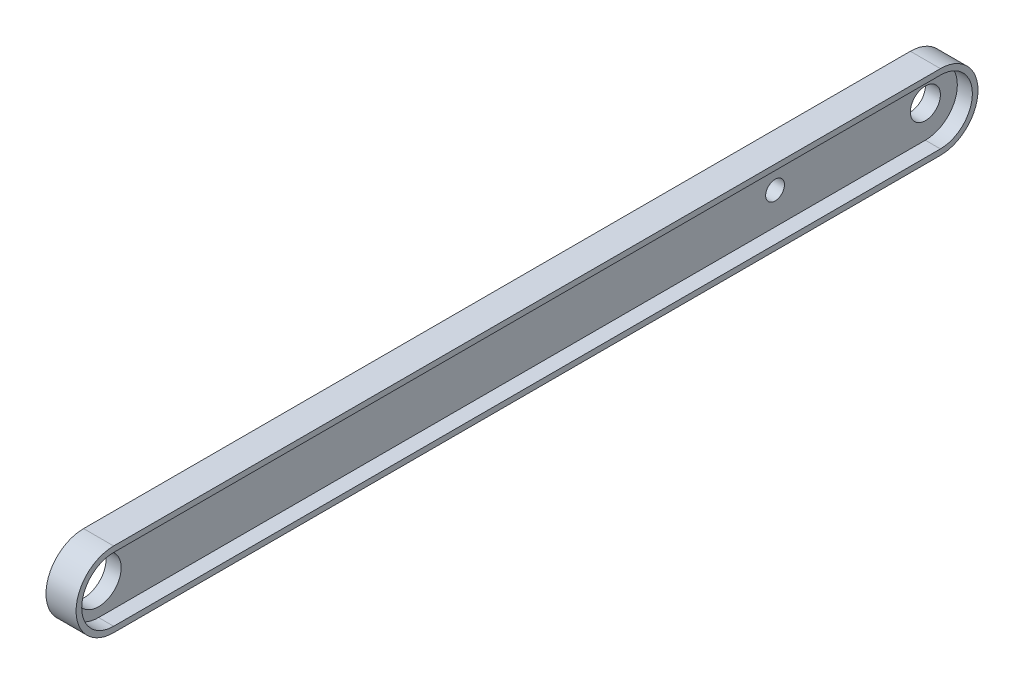
from build123d import *

# Parameters (mm, degrees)
SKETCH1_R           = 3
SKETCH1_R_2         = 2
SKETCH1_R_3         = 1.25
BOSS_EXTRUDE1_DEPTH = 2
BOSS_EXTRUDE3_DEPTH = 2


with BuildPart() as part:
    # Sketch1 → Boss-Extrude1 (new body)
    with BuildSketch(Plane(origin=(0, 0, 0), x_dir=(0, 0, -1), z_dir=(1, 0, 0))):
        with BuildLine():
            Line((0, 0), (110, 0))
            ThreePointArc((110, 0), (115, 5), (110, 10))
            Line((110, 10), (0, 10))
            ThreePointArc((0, 10), (-5, 5), (0, 0))
        make_face()
        with Locations((0, 5)):
            Circle(SKETCH1_R, mode=Mode.SUBTRACT)
        with Locations((110, 5)):
            Circle(SKETCH1_R_2, mode=Mode.SUBTRACT)
        with Locations((90, 5)):
            Circle(SKETCH1_R_3, mode=Mode.SUBTRACT)
    extrude(amount=BOSS_EXTRUDE1_DEPTH)

    # Sketch2 → Boss-Extrude3 (add)
    with BuildSketch(Plane(origin=(2, 0, 0), x_dir=(0, 0, -1), z_dir=(1, 0, 0))):
        with BuildLine():
            Line((0, 0), (110, 0))
            ThreePointArc((110, 0), (115, 5), (110, 10))
            Line((110, 10), (0, 10))
            ThreePointArc((0, 10), (-5, 5), (0, 0))
        make_face()
        with BuildLine():
            Line((0, 9.25), (110, 9.25))
            ThreePointArc((110, 9.25), (114.25, 5), (110, 0.75))
            Line((110, 0.75), (0, 0.75))
            ThreePointArc((0, 0.75), (-4.25, 5), (0, 9.25))
        make_face(mode=Mode.SUBTRACT)
    extrude(amount=BOSS_EXTRUDE3_DEPTH)


solid = part.part
